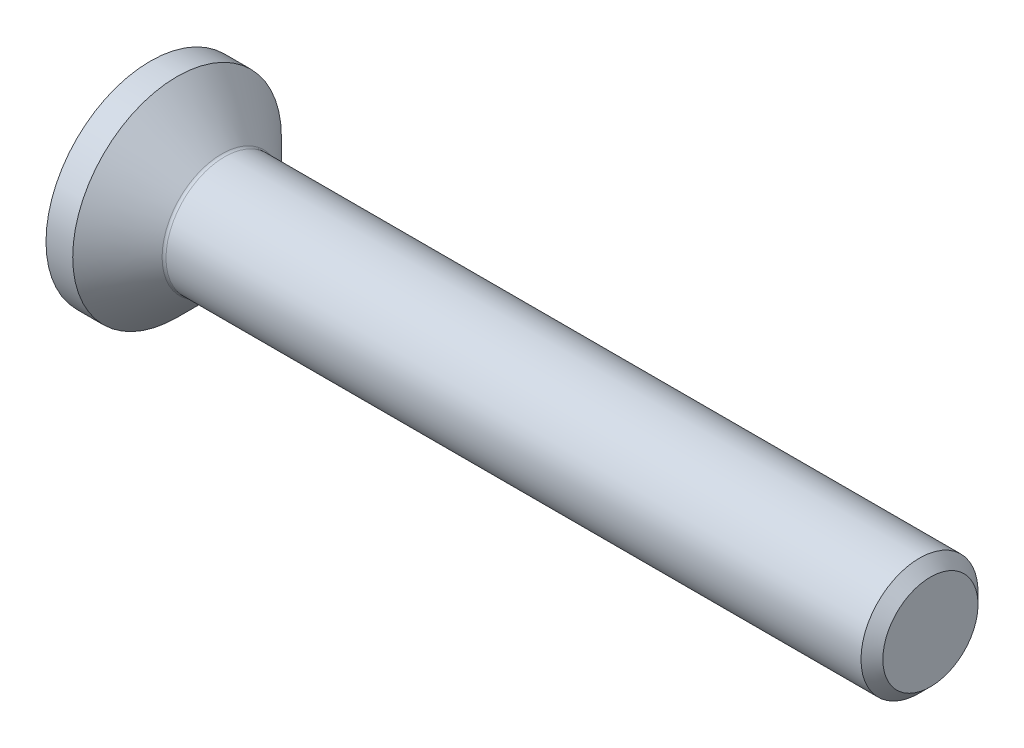
from build123d import *

# Parameters (mm, degrees)
FILLET1_R   = 0.1
HEX_2_DEPTH = 1.1


with BuildPart() as part:
    # BodySke → BaseBody (revolve)
    with BuildSketch(Plane.XY):
        Polygon((0, 0), (0, 2.675), (0.685, 2.675), (1.86, 1.5), (19.7195, 1.5), (20, 1.2195), (20, 0), align=None)
    revolve(axis=Axis((0, 0, 0), (1, 0, 0)))

    # Fillet1
    fillet1_edges = [part.edges().sort_by_distance(p)[0] for p in [
        (1.86, -1.5, 0),
    ]]
    fillet(fillet1_edges, radius=FILLET1_R)

    # Sketch2 → PreBroach (revolve, cut)
    with BuildSketch(Plane.XY):
        Polygon((0, 1), (1.1, 1), (1.677350269, 0), (0, 0), align=None)
    revolve(axis=Axis((0, 0, 0), (1, 0, 0)), mode=Mode.SUBTRACT)

    # Sketch3 → Hex 2 (cut)
    with BuildSketch(Plane.ZY):
        Polygon((-1, -0.577350269), (-1, 0.577350269), (0, 1.154700538), (1, 0.577350269), (1, -0.577350269), (0, -1.154700538), align=None)
    extrude(amount=-HEX_2_DEPTH, mode=Mode.SUBTRACT)


solid = part.part
